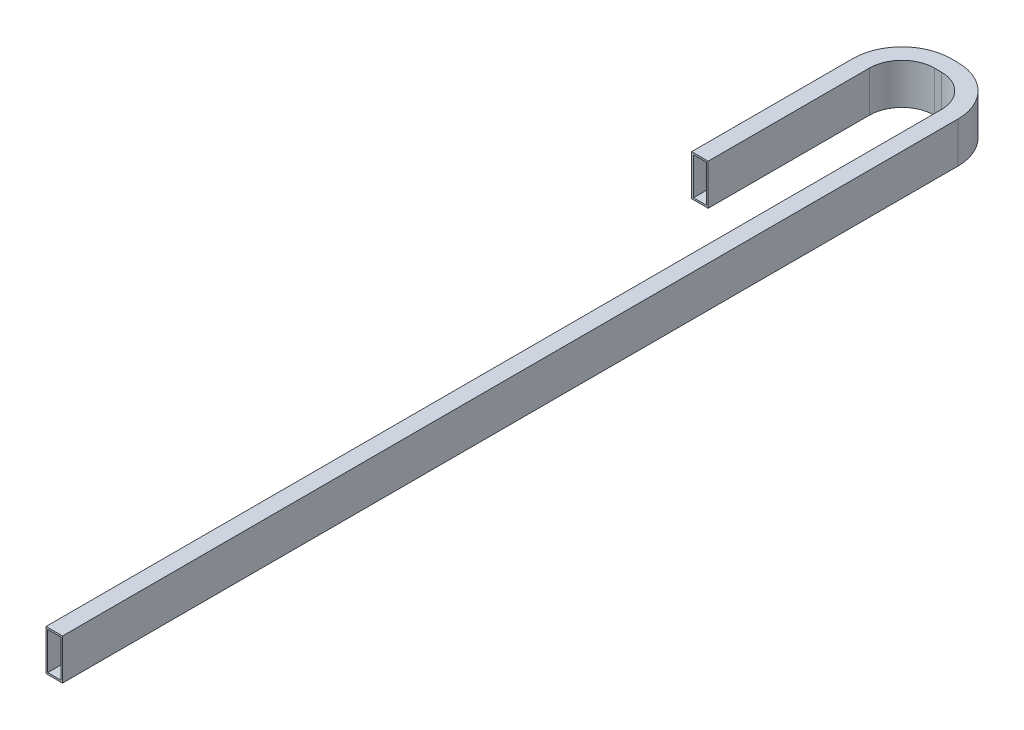
from build123d import *

# Parameters (mm, degrees)
SKETCH1_W      = 14.986
SKETCH1_H      = 37.084
SKETCH1_W_2    = 11.811
SKETCH1_H_2    = 33.909
EXTRUDE1_DEPTH = 12.7
SKETCH2_W      = 14.986
SKETCH2_H      = 37.084
SKETCH2_W_2    = 11.811
SKETCH2_H_2    = 33.909
EXTRUDE2_DEPTH = 12.7
SKETCH3_W      = 14.986
SKETCH3_H      = 37.084
SKETCH3_W_2    = 11.811
SKETCH3_H_2    = 33.909


with BuildPart() as part:
    # Sketch1 → Extrude1 (new body)
    with BuildSketch(Plane.XY):
        with Locations((13.843, 88.392)):
            Rectangle(SKETCH1_W, SKETCH1_H)
        with Locations((13.843, 88.392)):
            Rectangle(SKETCH1_W_2, SKETCH1_H_2, mode=Mode.SUBTRACT)
    extrude(amount=-EXTRUDE1_DEPTH)



with BuildPart() as body_2:
    # Sketch2 → Extrude2 (new body)
    with BuildSketch(Plane.XY.offset(666.75)):
        with Locations((94.107, 88.392)):
            Rectangle(SKETCH2_W, SKETCH2_H)
        with Locations((94.107, 88.392)):
            Rectangle(SKETCH2_W_2, SKETCH2_H_2, mode=Mode.SUBTRACT)
    extrude(amount=-EXTRUDE2_DEPTH)


with BuildPart() as part_1:
    add(part.part)

    add(body_2.part)  # Sweep1 merges body 2
    # Sweep1: sweep along a curve in space
    with BuildLine() as sweep1_path:
        Line((101.6, 69.85, 654.05), (101.6, 69.85, -146.513751223))
        ThreePointArc((101.6, 69.85, -146.513751223), (88.580896424, 69.85, -177.944647647), (57.15, 69.85, -190.963751223))
        Line((57.15, 69.85, -190.963751223), (50.8, 69.85, -190.963751223))
        ThreePointArc((6.35, 69.85, -146.513751223), (19.369103576, 69.85, -177.944647647), (50.8, 69.85, -190.963751223))
        Line((6.35, 69.85, -146.513751223), (6.35, 69.85, -12.7))
    # Sketch3 → Sweep1 (sweep)
    with BuildSketch(Plane(origin=(0, 0, 654.05), x_dir=(-1, 0, 0), z_dir=(0, 0, -1))):
        with Locations((-94.107, 88.392)):
            Rectangle(SKETCH3_W, SKETCH3_H)
        with Locations((-94.107, 88.392)):
            Rectangle(SKETCH3_W_2, SKETCH3_H_2, mode=Mode.SUBTRACT)
    sweep(path=sweep1_path.line)


solid = part_1.part
